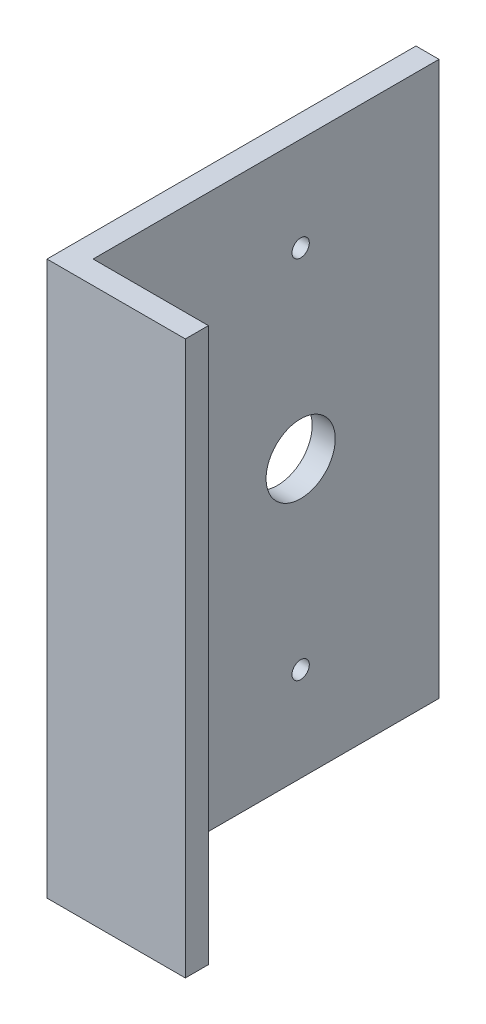
from build123d import *

# Parameters (mm, degrees)
EXTRUDE_THIN1_DEPTH = 76.2
SKETCH3_R           = 1.190625
SKETCH3_R_2         = 4.7625
CUT_EXTRUDE1_DEPTH  = 93.946735419


with BuildPart() as part:
    # Sketch2 → Extrude-Thin1 (new body)
    with BuildSketch(Plane(origin=(0, 0, 0), x_dir=(1, 0, 0), z_dir=(0, 1, 0))):
        Polygon((19.05, 0), (0, 0), (0, 50.8), (3.175, 50.8), (3.175, 3.175), (19.05, 3.175), align=None)
    extrude(amount=EXTRUDE_THIN1_DEPTH)

    # Sketch3 → Cut-Extrude1 (cut, through all)
    with BuildSketch(Plane(origin=(3.175, 0, 0), x_dir=(0, 0, -1), z_dir=(1, 0, 0))):
        with Locations((31.75, 63.246)):
            Circle(SKETCH3_R)
        with Locations((31.75, 12.954)):
            Circle(SKETCH3_R)
        with Locations((31.75, 38.1)):
            Circle(SKETCH3_R_2)
    extrude(amount=-CUT_EXTRUDE1_DEPTH, mode=Mode.SUBTRACT)


solid = part.part
